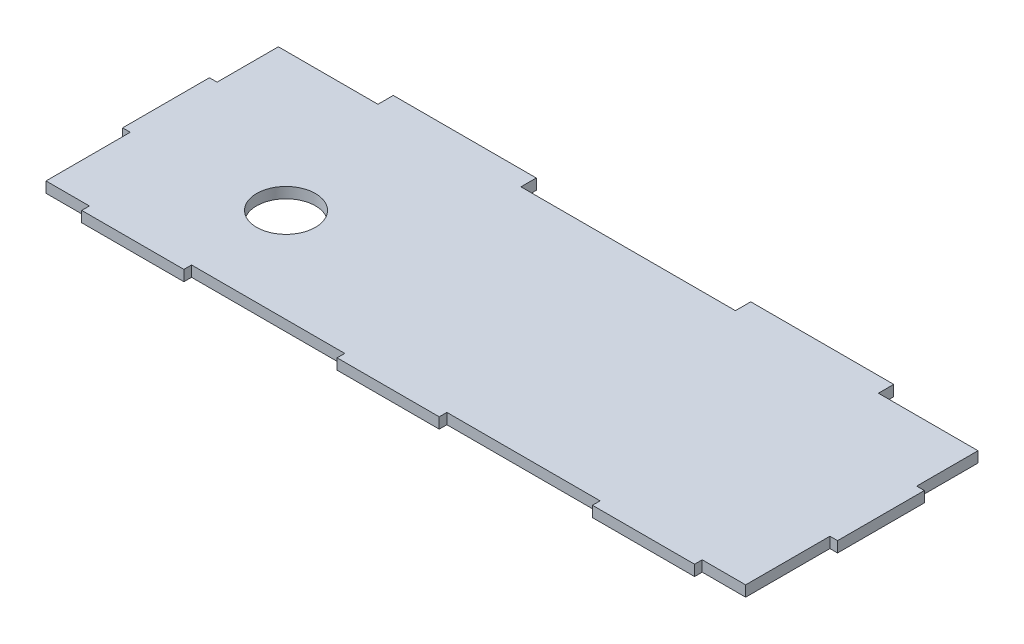
from build123d import *

# Parameters (mm, degrees)
BOSS_EXTRUDE1_DEPTH = 2.1
SKETCH3_R           = 5.75
CUT_EXTRUDE1_DEPTH  = 75.87763351
SKETCH4_W           = 1.5
SKETCH4_H           = 12
SKETCH4_W_2         = 30
SKETCH4_H_2         = 1.5
CUT_EXTRUDE2_DEPTH  = 75.87763351


with BuildPart() as part:
    # Sketch1 → Boss-Extrude1 (new body)
    with BuildSketch(Plane(origin=(0, 0, 0), x_dir=(1, 0, 0), z_dir=(0, 1, 0))):
        Polygon((-70, 23.5), (-49, 23.5), (-49, 26.5), (-21, 26.5), (-21, 23.5), (21, 23.5), (21, 26.5), (49, 26.5), (49, 23.5), (70, 23.5), (70, -23.5), (-70, -23.5), align=None)
    extrude(amount=BOSS_EXTRUDE1_DEPTH)

    # Sketch3 → Cut-Extrude1 (cut, through all)
    with BuildSketch(Plane(origin=(0, 2.1, 0), x_dir=(1, 0, 0), z_dir=(0, 1, 0))):
        with Locations(Location((-40, -3.5, 0), (0, 0, 270))):
            Circle(SKETCH3_R)
    extrude(amount=-CUT_EXTRUDE1_DEPTH, mode=Mode.SUBTRACT)

    # Sketch4 → Cut-Extrude2 (cut, through all)
    with BuildSketch(Plane(origin=(0, 2.1, 0), x_dir=(1, 0, 0), z_dir=(0, 1, 0))):
        with Locations((-69.25, 17.5)):
            Rectangle(SKETCH4_W, SKETCH4_H)
        Polygon((-70, -5.5), (-70, -23.5), (-60, -23.5), (-60, -22), (-68.5, -22), (-68.5, -5.5), align=None)
        with Locations((-25, -22.75)):
            Rectangle(SKETCH4_W_2, SKETCH4_H_2)
        with Locations((25, -22.75)):
            Rectangle(SKETCH4_W_2, SKETCH4_H_2)
        Polygon((60, -23.5), (70, -23.5), (70, -5.5), (68.5, -5.5), (68.5, -22), (60, -22), align=None)
        with Locations((69.25, 17.5)):
            Rectangle(SKETCH4_W, SKETCH4_H)
    extrude(amount=-CUT_EXTRUDE2_DEPTH, mode=Mode.SUBTRACT)


solid = part.part
